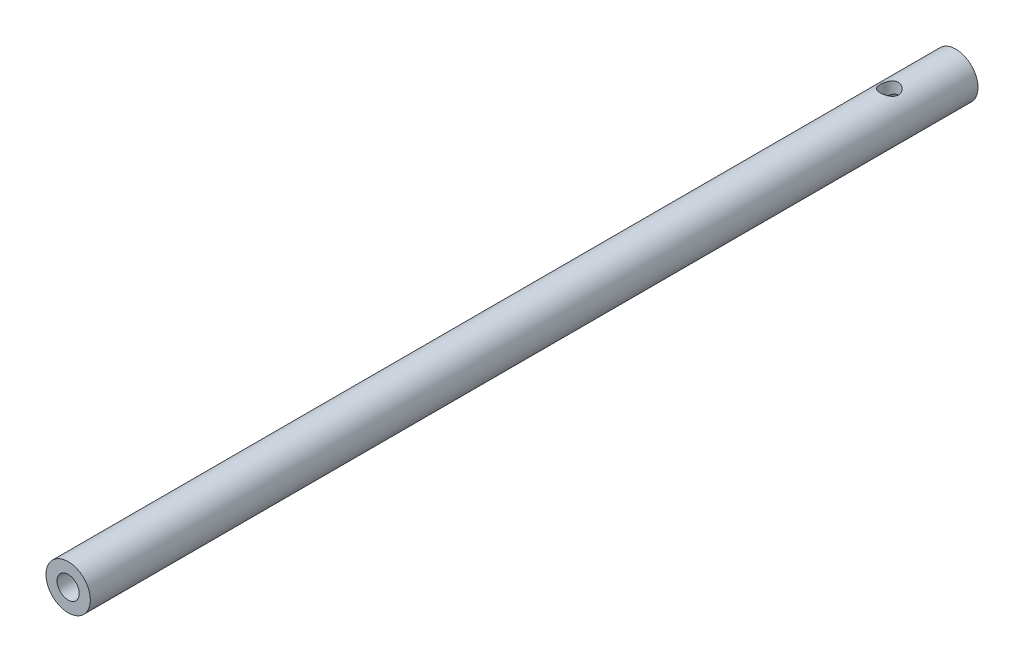
from build123d import *

# Parameters (mm, degrees)
SKETCH1_R               = 6.35
SKETCH1_R_2             = 3.175
BOSS_EXTRUDE1_DEPTH     = 254
CUT_EXTRUDE1_DEPTH      = 254
CUT_EXTRUDE1_DEPTH_BACK = 254
SKETCH2_R               = 2.6035


with BuildPart() as part:
    # Sketch1 → Boss-Extrude1 (new body)
    with BuildSketch(Plane.XY):
        Circle(SKETCH1_R)
        Circle(SKETCH1_R_2, mode=Mode.SUBTRACT)
    extrude(amount=BOSS_EXTRUDE1_DEPTH)

    # Sketch2 → Cut-Extrude1 (cut, two sides: drawn at the far end of the back side and taken through both)
    with BuildSketch(Plane(origin=(0, 0, 0), x_dir=(1, 0, 0), z_dir=(0, 1, 0)).offset(-CUT_EXTRUDE1_DEPTH_BACK)):
        with Locations((0, -19.05)):
            Circle(SKETCH2_R)
    extrude(amount=CUT_EXTRUDE1_DEPTH + CUT_EXTRUDE1_DEPTH_BACK, mode=Mode.SUBTRACT)


solid = part.part
